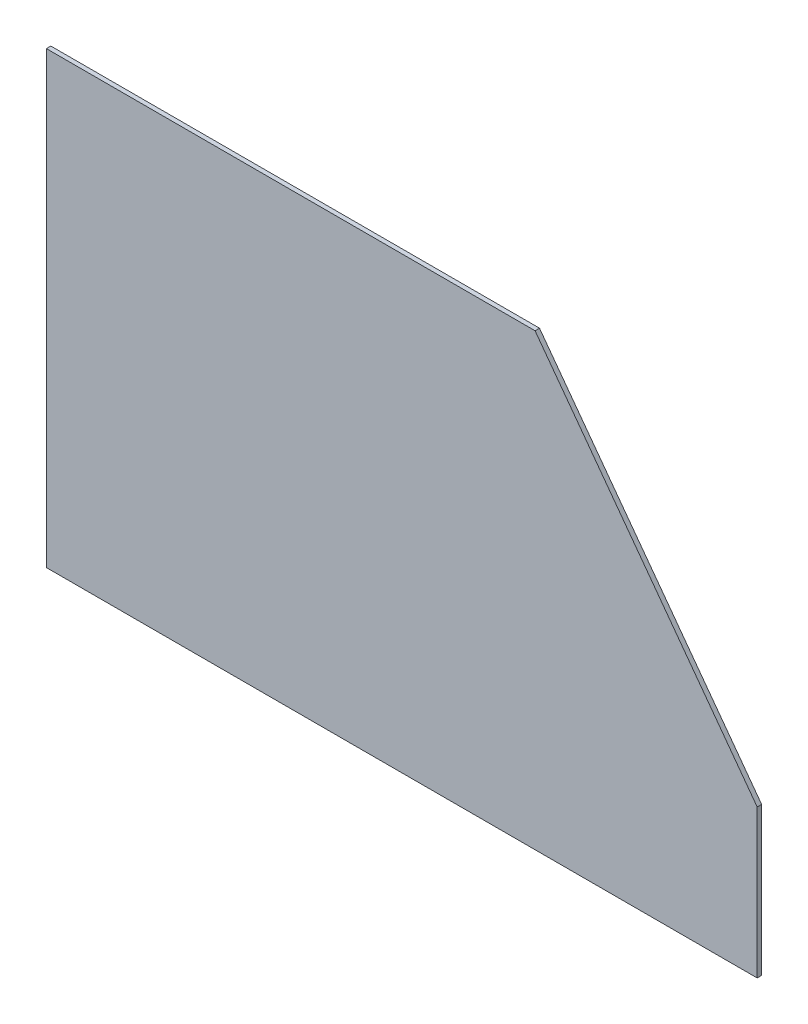
from build123d import *

# Parameters (mm, degrees)
BOSS_EXTRUDE1_DEPTH = 3


with BuildPart() as part:
    # Sketch1 → Boss-Extrude1 (new body)
    with BuildSketch(Plane.XY):
        Polygon((0, 0), (480, 0), (480, 100), (330, 303.5), (0, 303.5), align=None)
    extrude(amount=BOSS_EXTRUDE1_DEPTH)


solid = part.part
